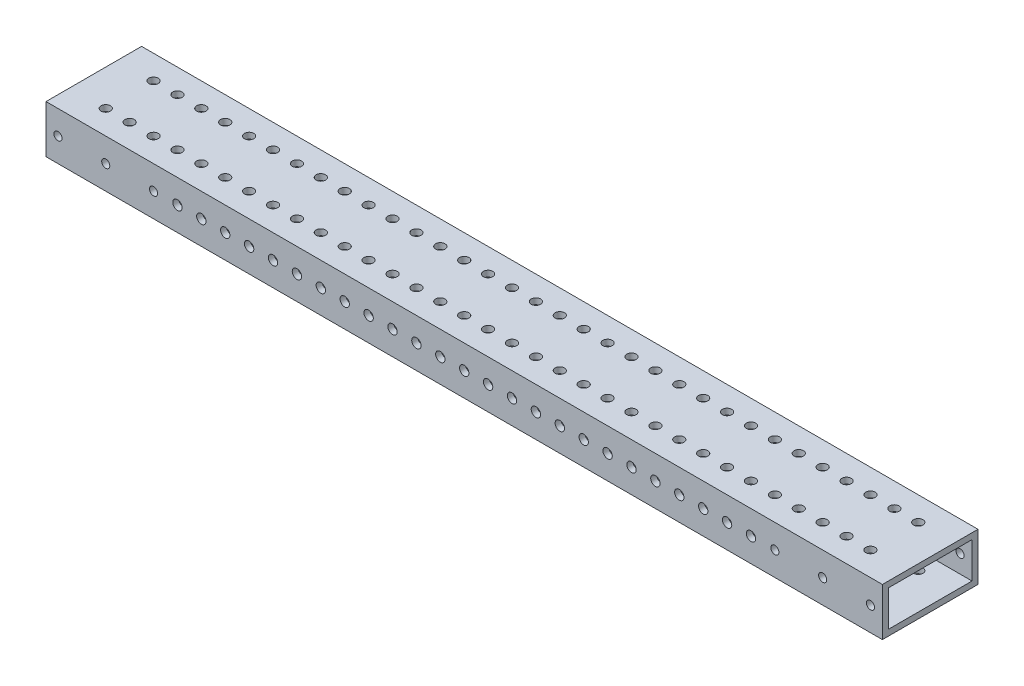
from build123d import *

# Parameters (mm, degrees)
SKETCH1_W           = 50.8
SKETCH1_H           = 25.4
BOSS_EXTRUDE1_DEPTH = 222.25
SHELL1_T            = -3.175
SKETCH2_R           = 2.15265
CUT_EXTRUDE1_DEPTH  = 230.392376726
SKETCH3_R           = 2.4892
CUT_EXTRUDE2_DEPTH  = 230.392376726
LPATTERN1_COUNT     = 25
LPATTERN1_PITCH     = 12.7
SKETCH6_R           = 2.4892
CUT_EXTRUDE3_DEPTH  = 230.392376726
LPATTERN2_COUNT     = 33
LPATTERN2_PITCH     = 12.7


with BuildPart() as part:
    # Sketch1 → Boss-Extrude1 (new, symmetric)
    with BuildSketch(Plane(origin=(0, 0, 0), x_dir=(0, 0, -1), z_dir=(1, 0, 0))):
        with Locations((25.4, 12.7)):
            Rectangle(SKETCH1_W, SKETCH1_H)
    extrude(amount=BOSS_EXTRUDE1_DEPTH, both=True)

    # Shell1
    shell1_openings = [part.faces().sort_by_distance(p)[0] for p in [
        (222.25, 12.7, -25.4),
        (-222.25, 12.7, -25.4),
    ]]
    offset(amount=SHELL1_T, openings=shell1_openings, kind=Kind.INTERSECTION)

    # Sketch2 → Cut-Extrude1 (cut, through all)
    with BuildSketch(Plane.XY):
        with Locations((-215.9, 12.7)):
            Circle(SKETCH2_R)
        with Locations((-190.5, 12.7)):
            Circle(SKETCH2_R)
        with Locations((-165.1, 12.7)):
            Circle(SKETCH2_R)
    cut_extrude1 = extrude(amount=-CUT_EXTRUDE1_DEPTH, mode=Mode.SUBTRACT)

    # Sketch3 → Cut-Extrude2 (cut, through all)
    with BuildSketch(Plane.XY):
        with Locations((-152.4, 12.7)):
            Circle(SKETCH3_R)
    cut_extrude2 = extrude(amount=-CUT_EXTRUDE2_DEPTH, mode=Mode.SUBTRACT)

    # Mirror1: Cut-Extrude1 across plane
    add(cut_extrude1.mirror(Plane(origin=(0, 0, 0), x_dir=(0, 0, 1), z_dir=(1, 0, 0))), mode=Mode.SUBTRACT)

    # LPattern1: Cut-Extrude2 ×25
    with Locations(*[(i * LPATTERN1_PITCH, 0, 0) for i in range(1, LPATTERN1_COUNT)]):
        add(cut_extrude2, mode=Mode.SUBTRACT)

    # Sketch6 → Cut-Extrude3 (cut, through all)
    with BuildSketch(Plane.XZ):
        with Locations((-203.2, -12.7)):
            Circle(SKETCH6_R)
        with Locations((-203.2, -38.1)):
            Circle(SKETCH6_R)
    cut_extrude3 = extrude(amount=-CUT_EXTRUDE3_DEPTH, mode=Mode.SUBTRACT)

    # LPattern2: Cut-Extrude3 ×33
    with Locations(*[(i * LPATTERN2_PITCH, 0, 0) for i in range(1, LPATTERN2_COUNT)]):
        add(cut_extrude3, mode=Mode.SUBTRACT)


solid = part.part
